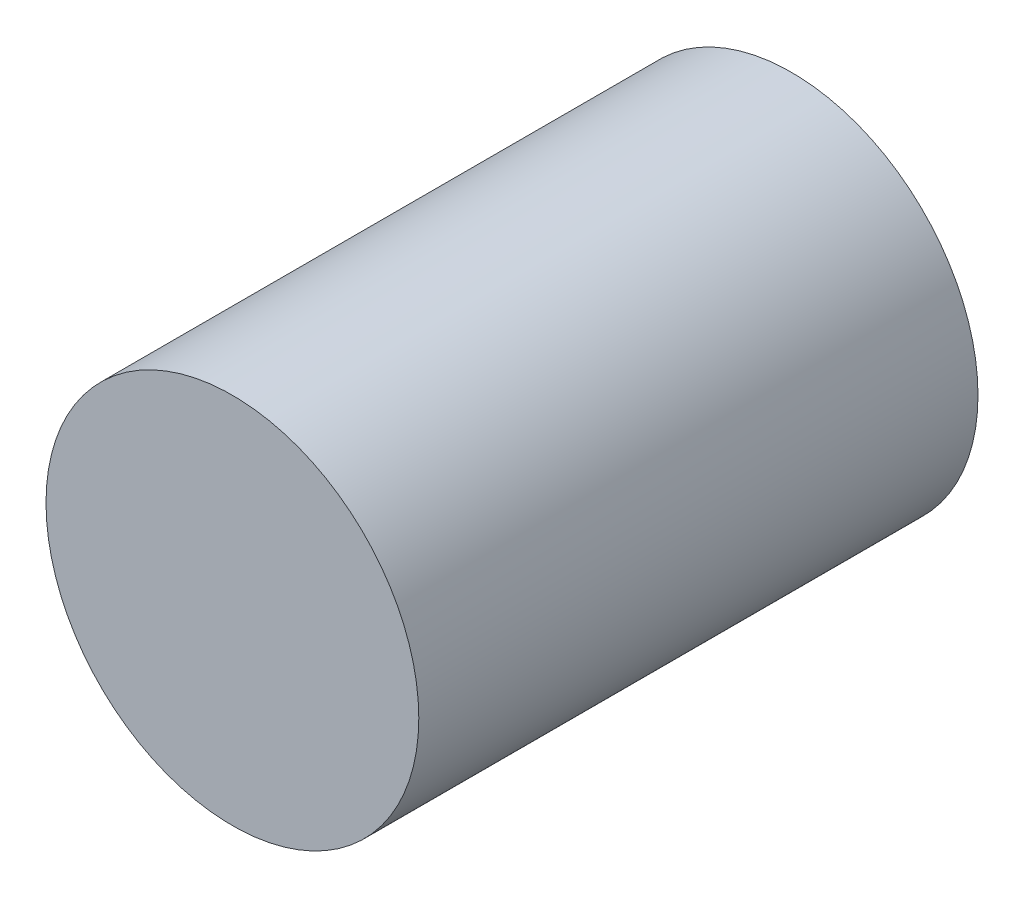
from build123d import *

# Parameters (mm, degrees)
SKETCH1_R           = 152.4
BOSS_EXTRUDE1_DEPTH = 457.2


with BuildPart() as part:
    # Sketch1 → Boss-Extrude1 (new body)
    with BuildSketch(Plane.XY):
        Circle(SKETCH1_R)
    extrude(amount=BOSS_EXTRUDE1_DEPTH)


solid = part.part
